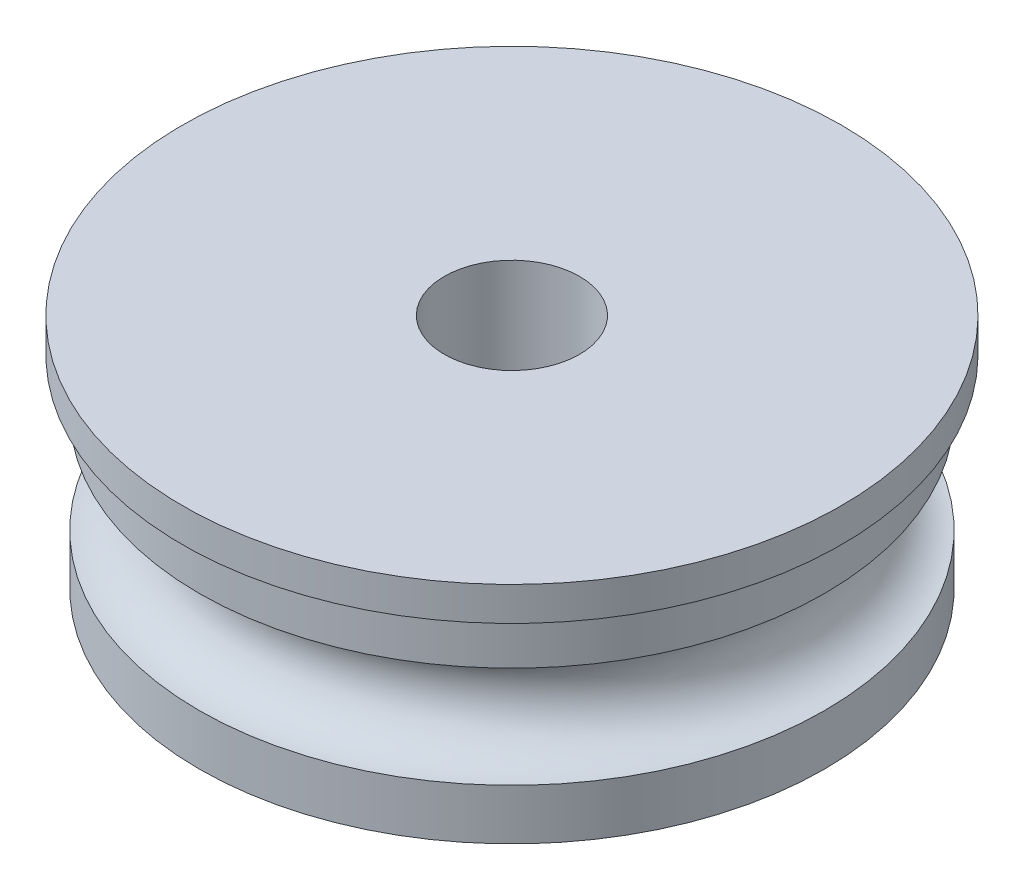
from build123d import *


with BuildPart() as part:
    # Sketch2 → Revolve1 (revolve)
    with BuildSketch(Plane.XY, mode=Mode.PRIVATE) as revolve1_sk:
        with BuildLine():
            Line((2, 1.693877551), (2, 5.693877551))
            Line((2, 5.693877551), (9.75, 5.693877551))
            Line((9.75, 5.693877551), (9.75, 4.693877551))
            Line((9.75, 4.693877551), (9.25, 4.693877551))
            Line((9.25, 4.693877551), (9.25, 3.193877551))
            ThreePointArc((9.25, 3.193877551), (7.75, 1.693877551), (9.25, 0.193877551))
            Line((9.25, 0.193877551), (9.25, -1.306122449))
            Line((9.25, -1.306122449), (6, -1.306122449))
            Line((6, -1.306122449), (6, 1.693877551))
            Line((6, 1.693877551), (2, 1.693877551))
        make_face()
    revolve(revolve1_sk.sketch.rotate(Axis((0, -8.632653061, 0), (0, 1, 0)), 90), axis=Axis((0, -8.632653061, 0), (0, 1, 0)))


solid = part.part
